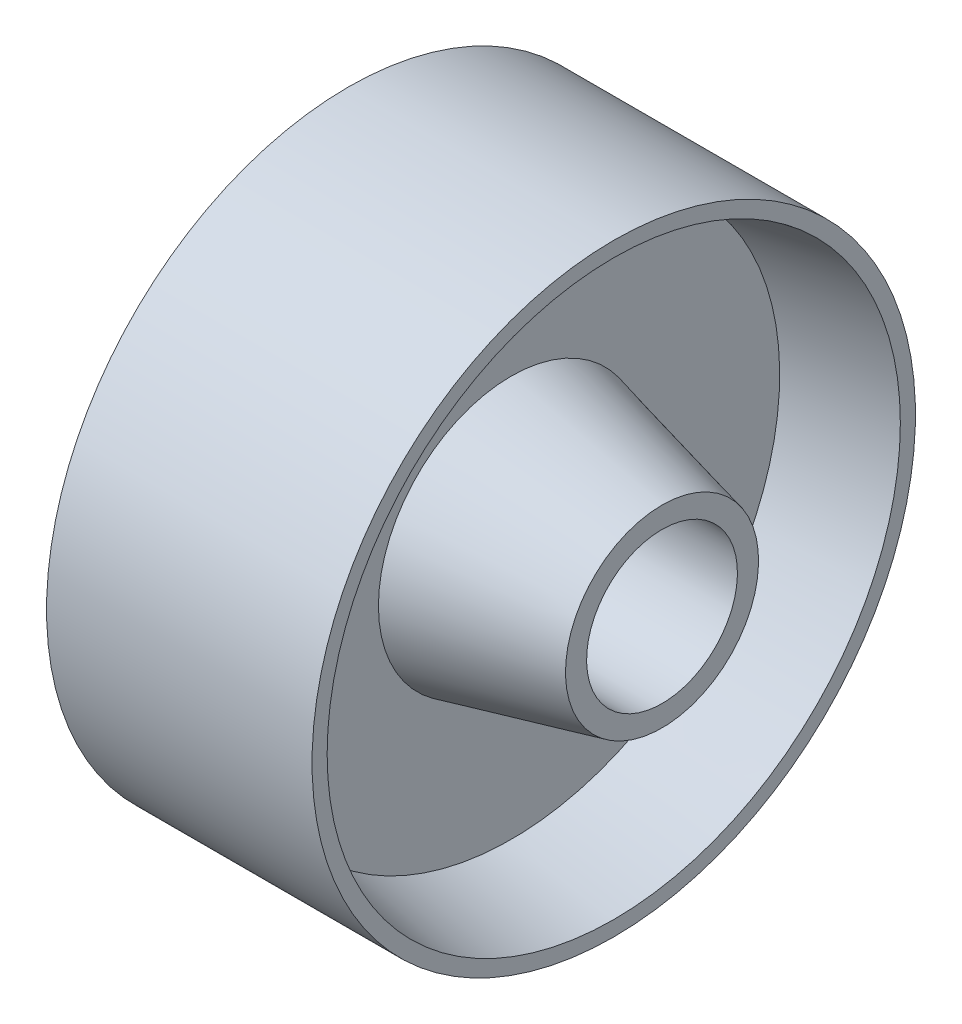
from build123d import *


with BuildPart() as part:
    # Croquis1 → Revolución1 (revolve)
    with BuildSketch(Plane.XY):
        Polygon((-5, 9.636363636), (-5, -12.863636364), (-30, -18.863636364), (-30, -22.363636364), (30, -22.363636364), (30, -18.863636364), (5, -12.863636364), (5, 9.636363636), (22, 12.636363636), (22, 15.136363636), (-22, 15.136363636), (-22, 12.636363636), align=None)
    revolve(axis=Axis((0, -34.863636364, 0), (-1, 0, 0)))


solid = part.part
